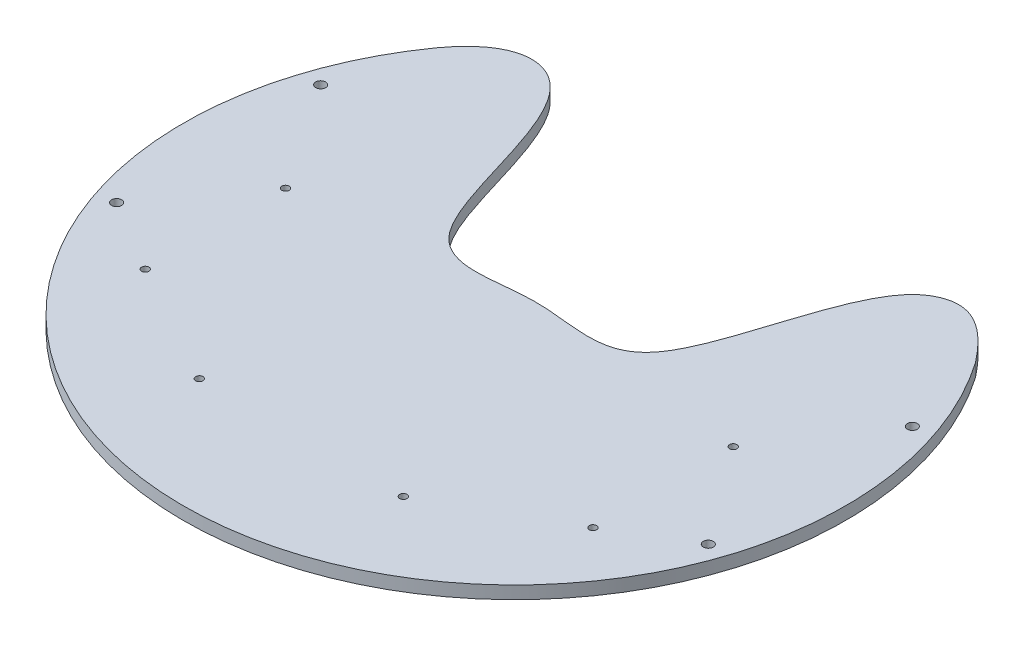
from build123d import *

# Parameters (mm, degrees)
SKETCH1_R                 = 164.975
BOSS_EXTRUDE1_DEPTH       = 6.35
F_6_CLEARANCE_HOLE1_D     = 3.6576
CUT_EXTRUDE1_DEPTH        = 234.396280497
CUT_EXTRUDE1_DEPTH_BACK   = 234.396280497
F_6_CLEARANCE_HOLE2_D     = 3.6576
F_6_CLEARANCE_HOLE2_DEPTH = 25.4
F_6_CLEARANCE_HOLE2_TIP   = 1.0988539
F_10_CLEARANCE_HOLE3_D    = 4.9784


with BuildPart() as part:
    # Sketch1 → Boss-Extrude1 (new body)
    with BuildSketch(Plane(origin=(0, 0, 0), x_dir=(1, 0, 0), z_dir=(0, 1, 0))):
        with Locations(Location((0, 0, 0), (0, 0, 270))):
            Circle(SKETCH1_R)
    extrude(amount=BOSS_EXTRUDE1_DEPTH)

    # #6 Clearance Hole1 (through all)
    with Locations(Plane(origin=(111.465, 0, 2.54), x_dir=(0, 0, -1), z_dir=(0, -1, 0))):
        with Locations((0, 0), (-69.85, 0), (-69.85, -222.93), (0, -222.93)):
            Hole(F_6_CLEARANCE_HOLE1_D / 2)

    # Sketch4 → Cut-Extrude1 (cut, two sides: drawn at the far end of the back side and taken through both)
    with BuildSketch(Plane(origin=(0, 6.35, 0), x_dir=(1, 0, 0), z_dir=(0, 1, 0)).offset(-CUT_EXTRUDE1_DEPTH_BACK)):
        with BuildLine():
            ThreePointArc((135.559273802, 94.023581677), (0.909023753, 164.972495589), (-134.514905155, 95.511731825))
            add(Edge.make_bspline(
                [(-134.514905155, 95.511731825), (-123.099313746, 111.400768261), (-106.148892425, 118.406504162), (-71.390187055, 97.759614567), (-62.101610339, -5.971047897), (0.172013059, 18.183800686), (61.336165132, -6.05350297), (73.495013895, 97.95601073), (105.334247953, 118.220752119), (120.053727673, 114.006940105), (135.559273802, 94.023581677)],
                knots=[0.002873593, 0.002873593, 0.002873593, 0.002873593, 0.096822713, 0.130284198, 0.334614856, 0.50142049, 0.668226124, 0.872556782, 0.905734169, 1, 1, 1, 1], degree=3))
        make_face()
    extrude(amount=CUT_EXTRUDE1_DEPTH + CUT_EXTRUDE1_DEPTH_BACK, mode=Mode.SUBTRACT)

    # #6 Clearance Hole2
    with Locations(Plane(origin=(50.8, 6.35, 106.158945667), x_dir=(0, 0, 1), z_dir=(0, 1, 0))):
        with Locations((0, 0), (0, -101.6)):
            Hole(F_6_CLEARANCE_HOLE2_D / 2, depth=F_6_CLEARANCE_HOLE2_DEPTH)
            with Locations((0, 0, -(F_6_CLEARANCE_HOLE2_DEPTH + F_6_CLEARANCE_HOLE2_TIP / 2))):  # 118° drill point
                Cone(0, F_6_CLEARANCE_HOLE2_D / 2, F_6_CLEARANCE_HOLE2_TIP, mode=Mode.SUBTRACT)

    # #10 Clearance Hole3 (through all)
    with Locations(Plane(origin=(0, 6.35, 0), x_dir=(-1, 0, 0), z_dir=(0, 1, 0))):
        with Locations((147.32, -50.8), (147.32, 50.8), (-147.32, -50.8), (-147.32, 50.8)):
            Hole(F_10_CLEARANCE_HOLE3_D / 2)


solid = part.part
